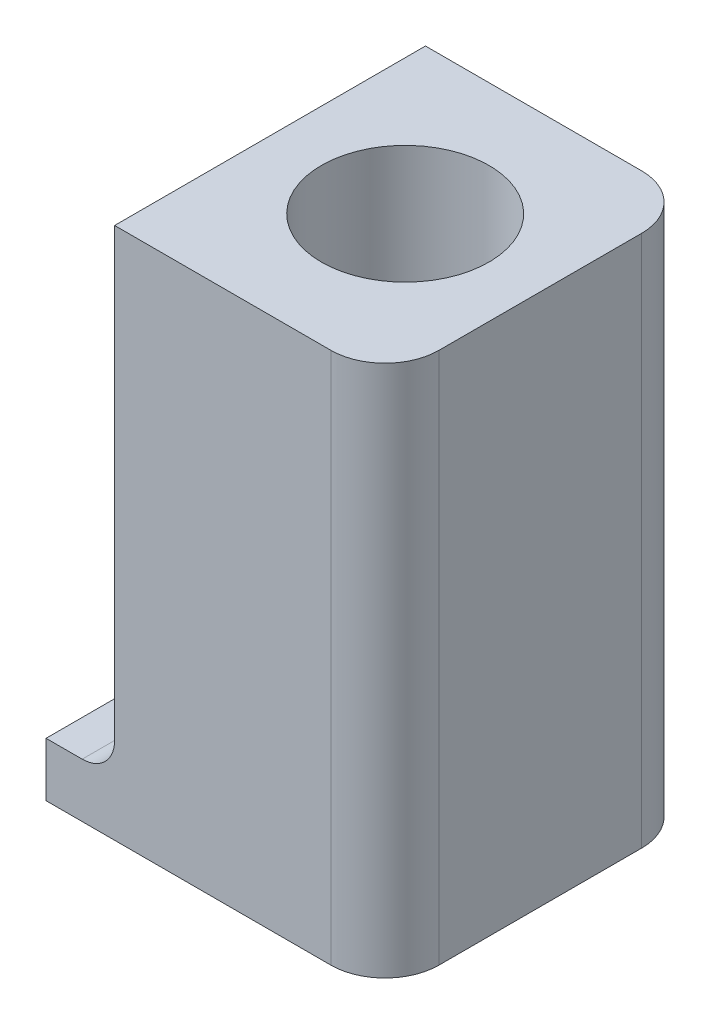
from build123d import *

# Parameters (mm, degrees)
SKETCH1_R                = 13.97
SKETCH1_R_2              = 1.275
BOSS_EXTRUDE1_DEPTH      = 3.048
BOSS_EXTRUDE2_DEPTH      = 46.99
BOSS_EXTRUDE2_DEPTH_BACK = 3.048
SKETCH2_R                = 7.874
SKETCH2_R_2              = 1.275
CUT_EXTRUDE2_DEPTH       = 117.959760362
SKETCH6_R                = 8.89
SKETCH6_R_2              = 4.191
BOSS_EXTRUDE3_DEPTH      = 4.572
FILLET2_R                = 3.048
SKETCH7_W                = 199.707818202
SKETCH7_H                = 58.861251681
CUT_EXTRUDE3_DEPTH       = 117.959760362


with BuildPart() as part:
    # Sketch1 → Boss-Extrude1 (new body)
    with BuildSketch(Plane(origin=(0, 0, 0), x_dir=(1, 0, 0), z_dir=(0, 1, 0))):
        with Locations(Location((0, 0, 0), (0, 0, 90))):
            Circle(SKETCH1_R)
        with Locations(Location((0, 9.5, 0), (0, 0, 90))):
            Circle(SKETCH1_R_2, mode=Mode.SUBTRACT)
        with Locations(Location((9.5, 0, 0), (0, 0, 90))):
            Circle(SKETCH1_R_2, mode=Mode.SUBTRACT)
        with Locations(Location((0, -9.5, 0), (0, 0, 90))):
            Circle(SKETCH1_R_2, mode=Mode.SUBTRACT)
        with Locations(Location((-9.5, 0, 0), (0, 0, 90))):
            Circle(SKETCH1_R_2, mode=Mode.SUBTRACT)
    extrude(amount=BOSS_EXTRUDE1_DEPTH)

    # Sketch2 → Boss-Extrude2 (add, two sides: drawn at the far end of the back side and taken through both)
    with BuildSketch(Plane(origin=(0, 3.048, 0), x_dir=(1, 0, 0), z_dir=(0, 1, 0)).offset(-BOSS_EXTRUDE2_DEPTH_BACK)):
        with BuildLine():
            Line((-96.52, -14.605), (96.52, -14.605))
            ThreePointArc((96.52, -14.605), (100.112102448, -13.117102448), (101.6, -9.525))
            Line((101.6, -9.525), (101.6, 9.525))
            ThreePointArc((101.6, 9.525), (100.112102448, 13.117102448), (96.52, 14.605))
            Line((96.52, 14.605), (-96.52, 14.605))
            ThreePointArc((-96.52, 14.605), (-100.112102448, 13.117102448), (-101.6, 9.525))
            Line((-101.6, 9.525), (-101.6, -9.525))
            ThreePointArc((-101.6, -9.525), (-100.112102448, -13.117102448), (-96.52, -14.605))
        make_face()
        with Locations(Location((-88.9, 0, 0), (0, 0, 270))):
            Circle(SKETCH2_R, mode=Mode.SUBTRACT)
        with Locations(Location((88.9, 0, 0), (0, 0, 270))):
            Circle(SKETCH2_R, mode=Mode.SUBTRACT)
        with Locations(Location((9.5, 0, 0), (0, 0, 90))):
            Circle(SKETCH2_R_2, mode=Mode.SUBTRACT)
        with Locations(Location((0, 9.5, 0), (0, 0, 90))):
            Circle(SKETCH2_R_2, mode=Mode.SUBTRACT)
        with Locations(Location((-9.5, 0, 0), (0, 0, 90))):
            Circle(SKETCH2_R_2, mode=Mode.SUBTRACT)
        with Locations(Location((0, -9.5, 0), (0, 0, 90))):
            Circle(SKETCH2_R_2, mode=Mode.SUBTRACT)
    extrude(amount=BOSS_EXTRUDE2_DEPTH + BOSS_EXTRUDE2_DEPTH_BACK)

    # Sketch5 → Cut-Extrude2 (cut, through all)
    with BuildSketch(Plane(origin=(0, 0, -14.605), x_dir=(-1, 0, 0), z_dir=(0, 0, -1))):
        Polygon((-76.2, 5.08), (0, 5.08), (76.2, 5.08), (76.2, 50.038), (-76.2, 50.038), align=None)
    extrude(amount=-CUT_EXTRUDE2_DEPTH, mode=Mode.SUBTRACT)

    # Sketch6 → Boss-Extrude3 (add)
    # profile 1 of 2: a face of its own
    with BuildSketch(Plane.XZ):
        with Locations((-88.9, 0)):
            Circle(SKETCH6_R)
        with Locations(Location((-88.9, 0, 0), (0, 0, 270))):
            Circle(SKETCH6_R_2, mode=Mode.SUBTRACT)
    # profile 2 of 2: a face of its own
    with BuildSketch(Plane.XZ):
        with Locations((88.9, 0)):
            Circle(SKETCH6_R)
        with Locations(Location((88.9, 0, 0), (0, 0, 270))):
            Circle(SKETCH6_R_2, mode=Mode.SUBTRACT)
    extrude(amount=-BOSS_EXTRUDE3_DEPTH)

    # Fillet2
    fillet2_edges = [part.edges().sort_by_distance(p)[0] for p in [
        (-76.2, 5.08, 0),
        (76.2, 5.08, 0),
    ]]
    fillet(fillet2_edges, radius=FILLET2_R)

    # Sketch7 → Cut-Extrude3 (cut, through all)
    with BuildSketch(Plane(origin=(0, 0, -14.605), x_dir=(-1, 0, 0), z_dir=(0, 0, -1))):
        with Locations((30.0995037, 26.703530829)):
            Rectangle(SKETCH7_W, SKETCH7_H)
    extrude(amount=-CUT_EXTRUDE3_DEPTH, mode=Mode.SUBTRACT)


solid = part.part
